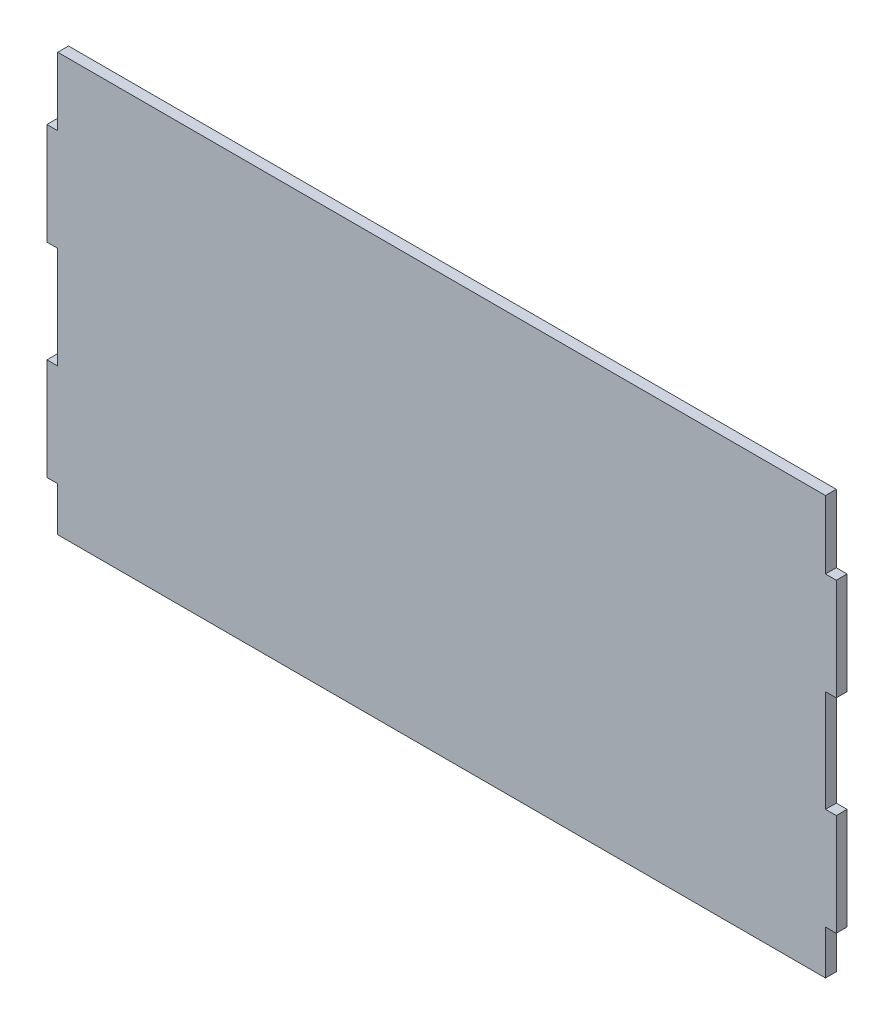
from build123d import *

# Parameters (mm, degrees)
SKETCH1_W           = 226
SKETCH1_H           = 123
BOSS_EXTRUDE1_DEPTH = 3.175
SKETCH2_W           = 3.175
SKETCH2_H           = 30
BOSS_EXTRUDE2_DEPTH = 3.175


with BuildPart() as part:
    # Sketch1 → Boss-Extrude1 (new body)
    with BuildSketch(Plane.XY):
        with Locations((113, -61.5)):
            Rectangle(SKETCH1_W, SKETCH1_H)
    extrude(amount=BOSS_EXTRUDE1_DEPTH)

    # Sketch2 → Boss-Extrude2 (add)
    with BuildSketch(Plane.XY.offset(3.175)):
        with Locations((-1.5875, -35)):
            Rectangle(SKETCH2_W, SKETCH2_H)
        with Locations((227.5875, -35)):
            Rectangle(SKETCH2_W, SKETCH2_H)
        with Locations((-1.5875, -95)):
            Rectangle(SKETCH2_W, SKETCH2_H)
        with Locations((227.5875, -95)):
            Rectangle(SKETCH2_W, SKETCH2_H)
    extrude(amount=-BOSS_EXTRUDE2_DEPTH)


solid = part.part
